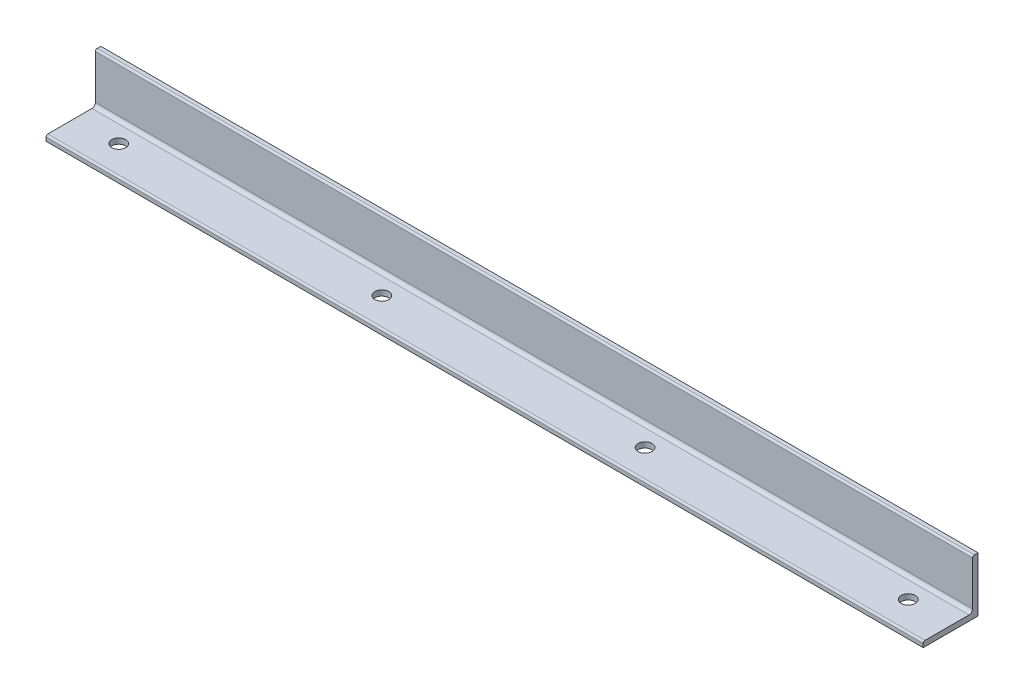
from build123d import *

# Parameters (mm, degrees)
BOSS_EXTRUDE1_DEPTH = 254
SKETCH3_R           = 2.0193
CUT_EXTRUDE1_DEPTH  = 257.615737404


with BuildPart() as part:
    # Sketch6 → Boss-Extrude1 (new body)
    with BuildSketch(Plane(origin=(0, 0, 0), x_dir=(0, 0, -1), z_dir=(1, 0, 0))):
        with BuildLine():
            Line((17.0434, 0), (32.9184, 0))
            Line((32.9184, 0), (32.9184, 15.875))
            Line((32.9184, 15.875), (31.8516, 15.875))
            ThreePointArc((31.8516, 15.875), (31.492389755, 15.726210245), (31.3436, 15.367))
            Line((31.3436, 15.367), (31.3436, 2.5908))
            ThreePointArc((31.3436, 2.5908), (31.04602049, 1.87237951), (30.3276, 1.5748))
            Line((30.3276, 1.5748), (17.5514, 1.5748))
            ThreePointArc((17.5514, 1.5748), (17.192189755, 1.426010245), (17.0434, 1.0668))
            Line((17.0434, 1.0668), (17.0434, 0))
        make_face()
    extrude(amount=-BOSS_EXTRUDE1_DEPTH)

    # Sketch3 → Cut-Extrude1 (cut, through all)
    with BuildSketch(Plane(origin=(0, 0, 0), x_dir=(1, 0, 0), z_dir=(0, 1, 0))):
        with Locations(Location((-12.7, 25.4, 0), (0, 0, 270))):
            Circle(SKETCH3_R)
        with Locations(Location((-88.9, 25.4, 0), (0, 0, 270))):
            Circle(SKETCH3_R)
        with Locations(Location((-165.1, 25.4, 0), (0, 0, 270))):
            Circle(SKETCH3_R)
        with Locations(Location((-241.3, 25.4, 0), (0, 0, 270))):
            Circle(SKETCH3_R)
    extrude(amount=CUT_EXTRUDE1_DEPTH, mode=Mode.SUBTRACT)


solid = part.part
